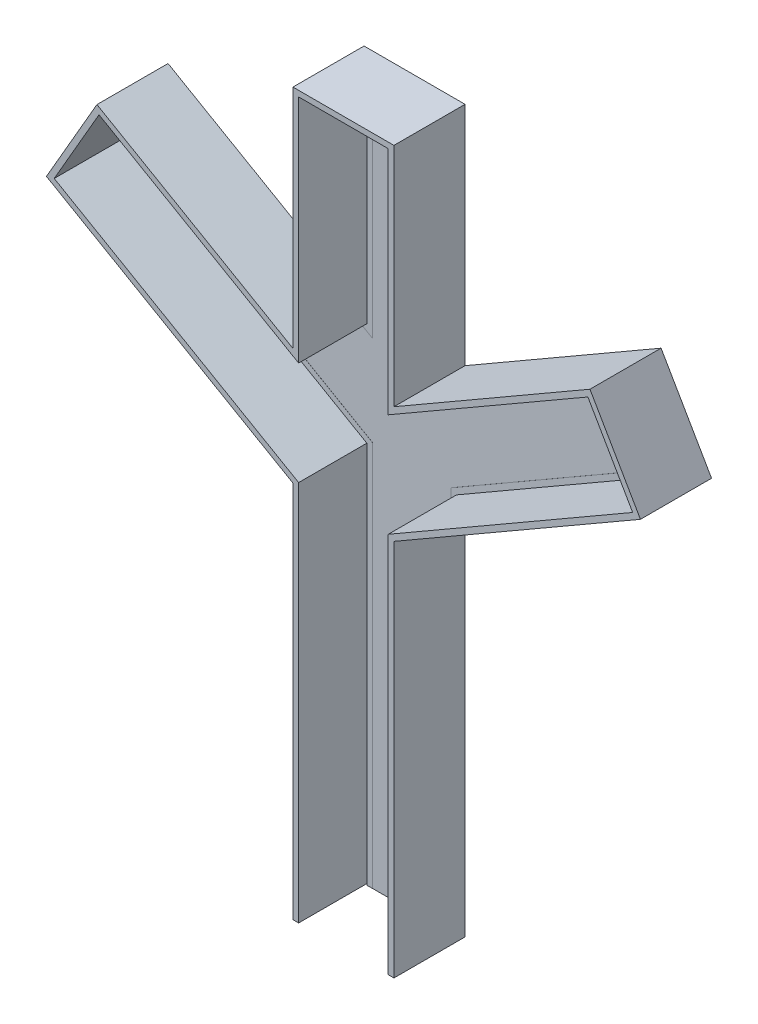
from build123d import *

# Parameters (mm, degrees)
BOSS_EXTRUDE1_DEPTH = 0.41
BOSS_EXTRUDE2_DEPTH = 0.4
BOSS_EXTRUDE3_DEPTH = 10


with BuildPart() as part:
    # Sketch1 → Boss-Extrude1 (new body)
    with BuildSketch(Plane.XY):
        Polygon((-5.5, 17), (-5.5, 71.298294078), (-39.578838325, 90.973720558), (-34.078838325, 100.5), (-5.5, 84), (-5.5, 117), (5.5, 117), (5.5, 84), (34.078838325, 100.5), (39.578838325, 90.973720558), (5.5, 71.298294078), (5.5, 17), (6.3, 17), (6.3, 70.836413862), (40.671658648, 90.680900235), (34.371658648, 101.592820323), (6.3, 85.385640646), (6.3, 117.8), (-6.3, 117.8), (-6.3, 85.385640646), (-34.371658648, 101.592820323), (-40.671658648, 90.680900235), (-6.3, 70.836413862), (-6.3, 17), align=None)
    extrude(amount=BOSS_EXTRUDE1_DEPTH)

    # Sketch2 → Boss-Extrude2 (add)
    with BuildSketch(Plane.XY):
        Polygon((-5.5, 17), (-5.5, 71.298294078), (-39.578838325, 90.973720558), (-34.078838325, 100.5), (-5.5, 84), (-5.5, 117), (5.5, 117), (5.5, 84), (34.078838325, 100.5), (39.578838325, 90.973720558), (5.5, 71.298294078), (5.5, 17), align=None)
    extrude(amount=BOSS_EXTRUDE2_DEPTH)

    # Sketch3 → Boss-Extrude3 (add)
    with BuildSketch(Plane.XY):
        Polygon((-6.3, 17.2), (-6.3, 70.836413862), (-40.671658648, 90.680900235), (-34.371658648, 101.592820323), (-6.3, 85.385640646), (-6.3, 117.8), (6.3, 117.8), (6.3, 85.385640646), (34.371658648, 101.592820323), (40.671658648, 90.680900235), (6.3, 70.836413862), (6.3, 17.2), (7.1, 17.2), (7.1, 70.374533647), (41.764478971, 90.388079912), (34.664478971, 102.685640646), (7.1, 86.771281292), (7.1, 118.6), (-7.1, 118.6), (-7.1, 86.771281292), (-34.664478971, 102.685640646), (-41.764478971, 90.388079912), (-7.1, 70.374533647), (-7.1, 17.2), align=None)
    extrude(amount=BOSS_EXTRUDE3_DEPTH)


solid = part.part
